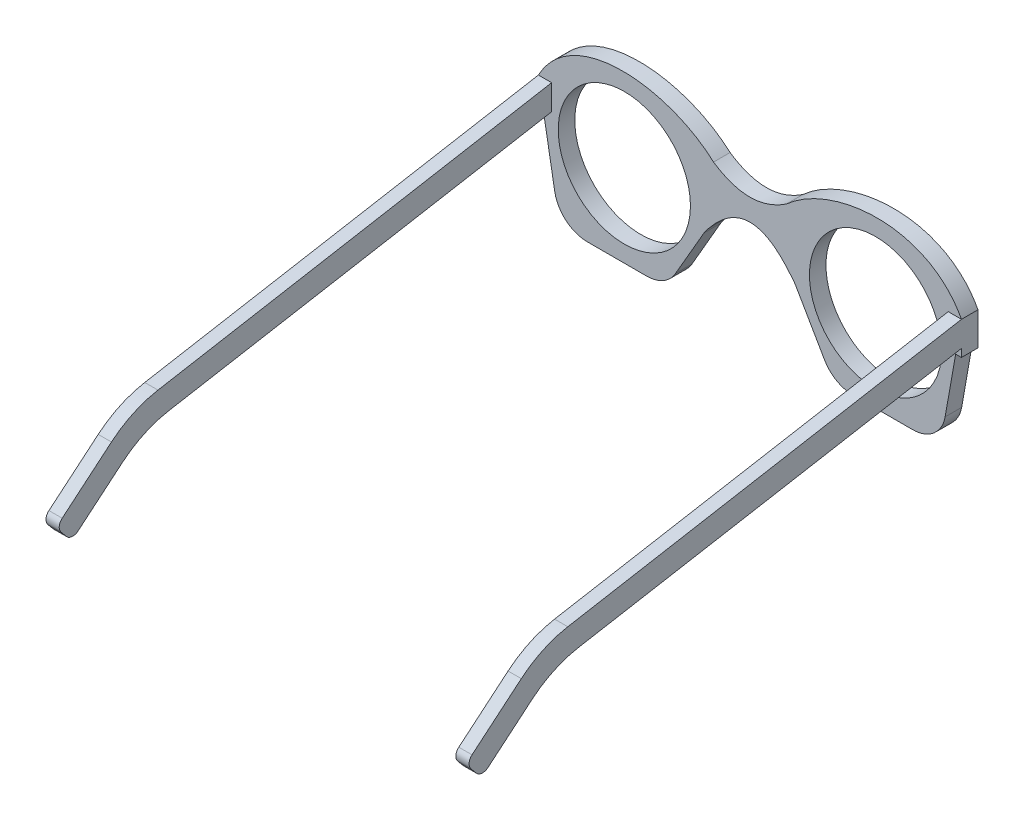
from build123d import *

# Parameters (mm, degrees)
SKETCH1_R           = 20
BOSS_EXTRUDE1_DEPTH = 5
BOSS_EXTRUDE2_DEPTH = 4


with BuildPart() as part:
    # Sketch1 → Boss-Extrude1 (new body)
    # profile 1 of 4: a face of its own
    with BuildSketch(Plane.XY):
        with BuildLine():
            Line((0, 14.047165148), (0, 20.609217456))
            add(Edge.make_bspline(
                [(0, 20.609217456), (-5.5, 20.609217456), (-11, 24.303121583)],
                knots=[0.5, 0.5, 0.5, 1, 1, 1], degree=2))
            add(Edge.make_bspline(
                [(-11, 24.303121583), (-25.025952509, 37.034801988), (-53.805838246, 39.750693097), (-64, 20.609217456)],
                knots=[0, 0, 0, 0, 1, 1, 1, 1], degree=3))
            Line((-64, 20.609217456), (-62.236730193, 10.609217456))
            Line((-62.236730193, 10.609217456), (-59.055336952, -7.433360194))
            ThreePointArc((-59.055336952, -7.433360194), (-55.635135519, -13.357322848), (-49.207259422, -15.696878417))
            Line((-49.207259422, -15.696878417), (-31.207259422, -15.696878417))
            ThreePointArc((-31.207259422, -15.696878417), (-26.207259422, -14.357132455), (-22.547005384, -10.696878417))
            Line((-22.547005384, -10.696878417), (-13.886751346, 4.303121583))
            ThreePointArc((-13.886751346, 4.303121583), (-13.219249284, 5.312773474), (-12.434656927, 6.234386612))
            add(Edge.make_bspline(
                [(-12.434656927, 6.234386612), (-6.217328463, 14.047165148), (0, 14.047165148)],
                knots=[0.052283446, 0.052283446, 0.052283446, 0.5, 0.5, 0.5], degree=2))
        make_face()
        with Locations((-38, 9.303121583)):
            Circle(SKETCH1_R, mode=Mode.SUBTRACT)
    # profile 2 of 4: a face of its own
    with BuildSketch(Plane.XY):
        with BuildLine():
            add(Edge.make_bspline(
                [(11, 24.303121583), (5.5, 20.609217456), (0, 20.609217456)],
                knots=[0, 0, 0, 0.5, 0.5, 0.5], degree=2))
            Line((0, 20.609217456), (0, 14.047165148))
            add(Edge.make_bspline(
                [(0, 14.047165148), (6.217328463, 14.047165148), (12.434656927, 6.234386612)],
                knots=[0.5, 0.5, 0.5, 0.947716554, 0.947716554, 0.947716554], degree=2))
            ThreePointArc((12.434656927, 6.234386612), (13.219249284, 5.312773474), (13.886751346, 4.303121583))
            Line((13.886751346, 4.303121583), (22.547005384, -10.696878417))
            ThreePointArc((22.547005384, -10.696878417), (26.207259422, -14.357132455), (31.207259422, -15.696878417))
            Line((31.207259422, -15.696878417), (49.207259422, -15.696878417))
            ThreePointArc((49.207259422, -15.696878417), (55.635135519, -13.357322848), (59.055336952, -7.433360194))
            Line((59.055336952, -7.433360194), (62.236730193, 10.609217456))
            Line((62.236730193, 10.609217456), (64, 20.609217456))
            add(Edge.make_bspline(
                [(11, 24.303121583), (25.025952509, 37.034801988), (53.805838246, 39.750693097), (64, 20.609217456)],
                knots=[0, 0, 0, 0, 1, 1, 1, 1], degree=3))
        make_face()
        with Locations((38, 9.303121583)):
            Circle(SKETCH1_R, mode=Mode.SUBTRACT)
    # profile 3 of 4: a face of its own
    with BuildSketch(Plane.XY):
        Polygon((64, 10.609217456), (64, 20.609217456), (62.236730193, 10.609217456), align=None)
    # profile 4 of 4: a face of its own
    with BuildSketch(Plane.XY):
        Polygon((-62.236730193, 10.609217456), (-64, 20.609217456), (-64, 10.609217456), align=None)
    extrude(amount=BOSS_EXTRUDE1_DEPTH)

    # Sketch3 → Boss-Extrude2 (add)
    with BuildSketch(Plane.ZY.offset(64)):
        with BuildLine():
            Line((5, 20.609217456), (124.102313443, -0.391733869))
            ThreePointArc((124.102313443, -0.391733869), (131.571415965, -2.746732848), (138.176496403, -6.954633166))
            Line((138.176496403, -6.954633166), (153.084888892, -19.464259805))
            ThreePointArc((153.084888892, -19.464259805), (153.968406613, -21.161481556), (153.393030976, -22.986339937))
            Line((153.393030976, -22.986339937), (151.786061952, -24.901451044))
            ThreePointArc((151.786061952, -24.901451044), (150.088840201, -25.784968765), (148.26398182, -25.209593128))
            Line((148.26398182, -25.209593128), (134.895046755, -13.991724646))
            ThreePointArc((134.895046755, -13.991724646), (128.289966317, -9.783824329), (120.820863794, -7.428825349))
            Line((120.820863794, -7.428825349), (5, 12.993517867))
            Line((5, 12.993517867), (5, 10.609217456))
            Line((5, 10.609217456), (0, 10.609217456))
            Line((0, 10.609217456), (0, 20.609217456))
            Line((0, 20.609217456), (5, 20.609217456))
        make_face()
    boss_extrude2 = extrude(amount=-BOSS_EXTRUDE2_DEPTH)

    # Mirror1: Boss-Extrude2 across plane
    add(boss_extrude2.mirror(Plane(origin=(0, 0, 0), x_dir=(0, 0, 1), z_dir=(1, 0, 0))))


solid = part.part
